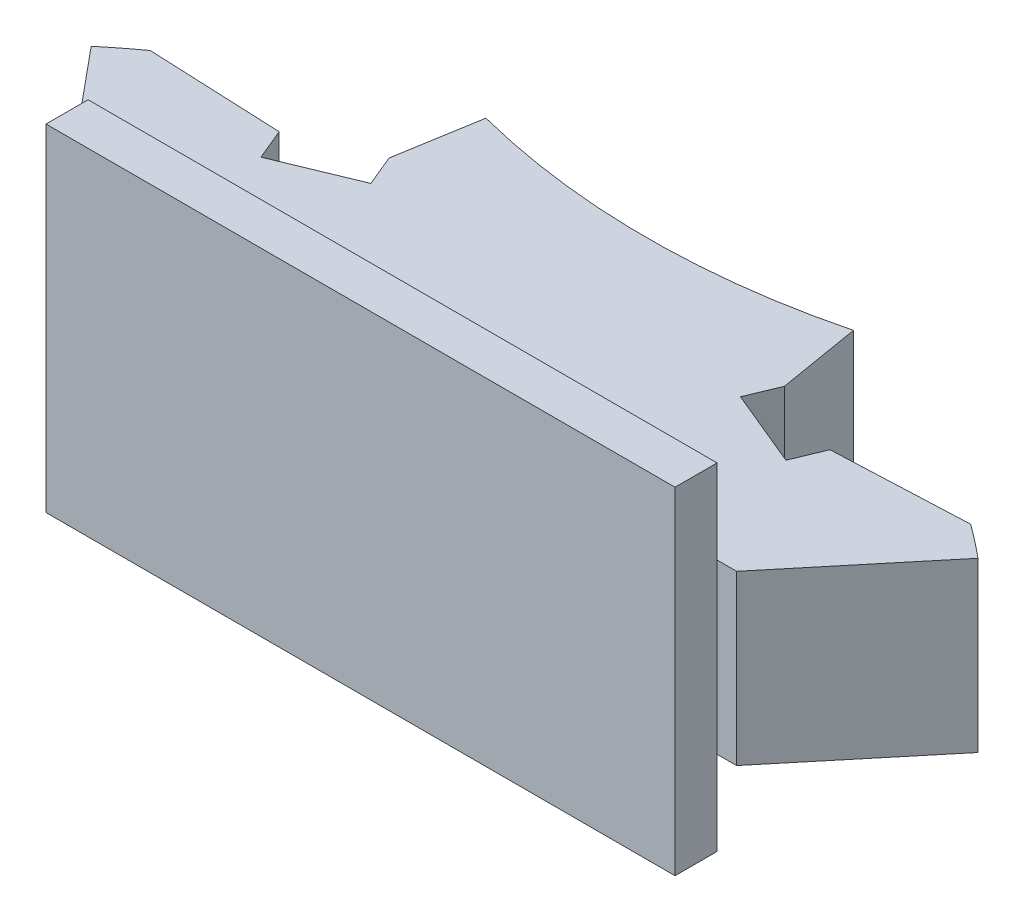
from build123d import *

# Parameters (mm, degrees)
BOSS_EXTRUDE1_DEPTH = 12.7
SKETCH1_5_W         = 47.483470806
SKETCH1_5_H         = 3.175
BOSS_EXTRUDE2_DEPTH = 6.35
SKETCH1_6_W         = 47.483470806
SKETCH1_6_H         = 3.175
BOSS_EXTRUDE3_DEPTH = 19.05


with BuildPart() as part:
    # Sketch1 → Boss-Extrude1 (new body)
    with BuildSketch(Plane(origin=(0, 0, 0), x_dir=(1, 0, 0), z_dir=(0, 1, 0))):
        with BuildLine():
            Line((25.211738376, -18.415), (33.470890643, -8.450179693))
            ThreePointArc((33.470890643, -8.450179693), (32.233303271, -7.455639016), (30.966181765, -6.499011214))
            Line((30.966181765, -6.499011214), (20.788013819, -6.943399623))
            Line((20.788013819, -6.943399623), (19.8159979, -9.290053636))
            Line((19.8159979, -9.290053636), (13.949362869, -6.86001384))
            Line((13.949362869, -6.86001384), (14.921378787, -4.513359828))
            Line((14.921378787, -4.513359828), (13.87332649, 1.749553742))
            ThreePointArc((13.87332649, 1.749553742), (0, 0), (-13.87332649, 1.749553742))
            Line((-13.87332649, 1.749553742), (-14.921378787, -4.513359828))
            Line((-14.921378787, -4.513359828), (-13.949362869, -6.86001384))
            Line((-13.949362869, -6.86001384), (-19.8159979, -9.290053636))
            Line((-19.8159979, -9.290053636), (-20.788013819, -6.943399623))
            Line((-20.788013819, -6.943399623), (-30.966181765, -6.499011214))
            ThreePointArc((-30.966181765, -6.499011214), (-32.233303271, -7.455639016), (-33.470890643, -8.450179693))
            Line((-33.470890643, -8.450179693), (-25.211738376, -18.415))
            Line((-25.211738376, -18.415), (25.211738376, -18.415))
        make_face()
    extrude(amount=-BOSS_EXTRUDE1_DEPTH)



with BuildPart() as body_2:
    # Sketch1<5> → Boss-Extrude2 (new body)
    with BuildSketch(Plane(origin=(0, 0, 0), x_dir=(1, 0, 0), z_dir=(0, 1, 0))):
        with Locations((0, -20.0025)):
            Rectangle(SKETCH1_5_W, SKETCH1_5_H)
    extrude(amount=BOSS_EXTRUDE2_DEPTH)


with BuildPart() as part_1:
    add(part.part)

    add(body_2.part)  # Boss-Extrude3 merges body 2
    # Sketch1<6> → Boss-Extrude3 (add)
    with BuildSketch(Plane(origin=(0, 0, 0), x_dir=(1, 0, 0), z_dir=(0, 1, 0))):
        with Locations((0, -20.0025)):
            Rectangle(SKETCH1_6_W, SKETCH1_6_H)
    extrude(amount=-BOSS_EXTRUDE3_DEPTH)


solid = part_1.part
